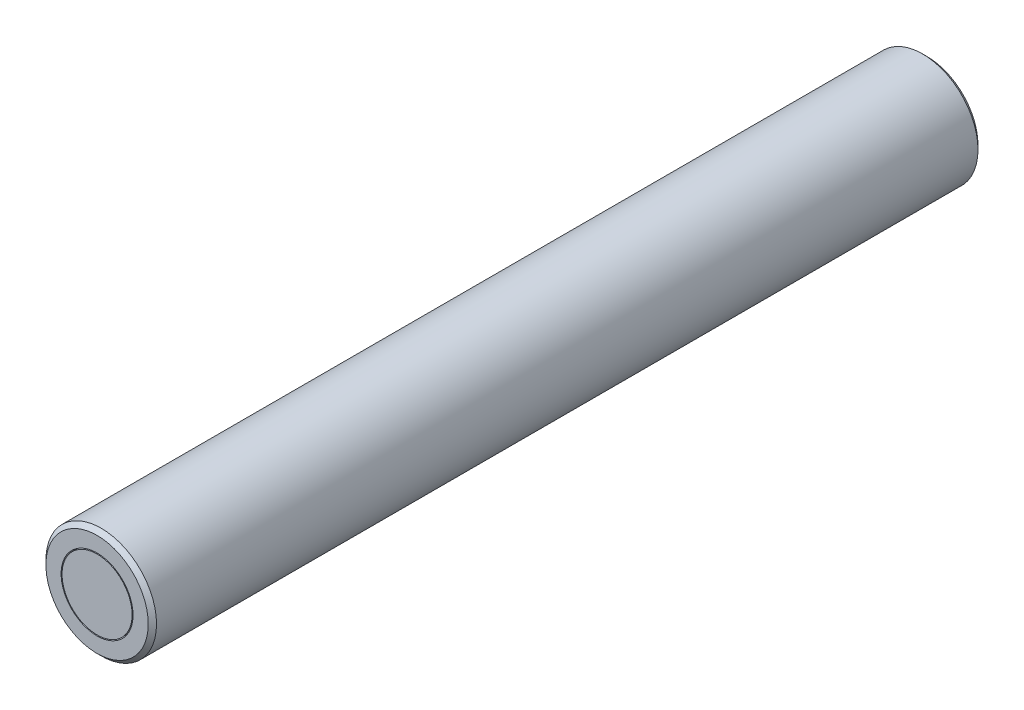
from build123d import *

# Parameters (mm, degrees)
SKETCH1_R           = 2
BOSS_EXTRUDE2_DEPTH = 30
SHELL1_T            = -0.7
END1_CHAMFER_SIZE   = 0.15
END2_CHAMFER_SIZE   = 0.15
SKETCH2_R           = 1.26660903
BOSS_EXTRUDE8_DEPTH = 30


with BuildPart() as part:
    # Sketch1 → Boss-Extrude2 (new body)
    with BuildSketch(Plane.XY):
        Circle(SKETCH1_R)
    extrude(amount=BOSS_EXTRUDE2_DEPTH)

    # Shell1
    shell1_openings = [part.faces().sort_by_distance(p)[0] for p in [
        (0, 0, 30),
        (0, 0, 0),
    ]]
    offset(amount=SHELL1_T, openings=shell1_openings, kind=Kind.INTERSECTION)

    # End1 Chamfer
    end1_chamfer_edges = [part.edges().sort_by_distance(p)[0] for p in [
        (-2, 0, 0),
    ]]
    chamfer(end1_chamfer_edges, length=END1_CHAMFER_SIZE)

    # End2 Chamfer
    end2_chamfer_edges = [part.edges().sort_by_distance(p)[0] for p in [
        (-2, 0, 30),
    ]]
    chamfer(end2_chamfer_edges, length=END2_CHAMFER_SIZE)


with BuildPart() as body_2:
    # Sketch2 → Boss-Extrude8 (new, through all)
    with BuildSketch(Plane.XY.offset(30)):
        Circle(SKETCH2_R)
    extrude(amount=-BOSS_EXTRUDE8_DEPTH)


solid = Compound([part.part, body_2.part])
